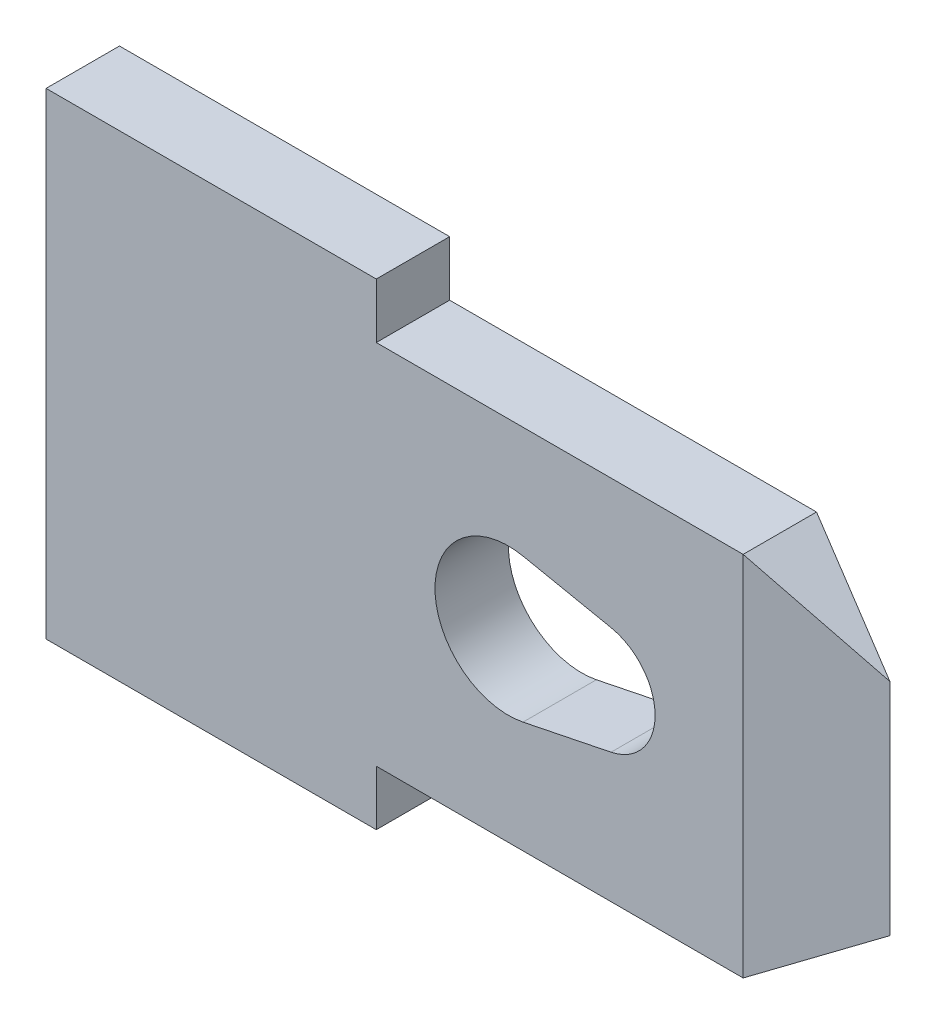
from build123d import *

# Parameters (mm, degrees)
DODANIE_WYCI_GNI_CIE1_DEPTH = 1
WYTNIJ_WYCI_GNI_CIE1_REACH  = 13.514
WYTNIJ_WYCI_GNI_CIE2_REACH  = 14.452


with BuildPart() as part:
    # Szkic1 → Dodanie-wyciągnięcie1 (new body)
    with BuildSketch(Plane.XY):
        Polygon((0, -3.25), (0, 3.25), (4.5, 3.25), (4.5, 2.5), (9.5, 2.5), (11, 1.5), (11, -1.5), (9.5, -2.5), (4.5, -2.5), (4.5, -3.25), align=None)
    extrude(amount=DODANIE_WYCI_GNI_CIE1_DEPTH)

    # Szkic2 → Wytnij-wyciągnięcie1 (cut, up to next)
    with BuildSketch(Plane.XY.offset(1), mode=Mode.PRIVATE) as wytnij_wyci_gni_cie1_sk1:
        with BuildLine():
            Line((6.5, 0.979795897), (7.7, 0.734846923))
            ThreePointArc((7.7, 0.734846923), (8.3, 0), (7.7, -0.734846923))
            Line((7.7, -0.734846923), (6.5, -0.979795897))
            ThreePointArc((6.5, -0.979795897), (5.3, 0), (6.5, 0.979795897))
        make_face()
    wytnij_wyci_gni_cie1_tool1 = extrude(wytnij_wyci_gni_cie1_sk1.sketch, amount=-WYTNIJ_WYCI_GNI_CIE1_REACH, mode=Mode.PRIVATE) & part.part
    add(wytnij_wyci_gni_cie1_tool1.solids().sort_by_distance((6.737463, 0, 1))[0], mode=Mode.SUBTRACT)

    # Wytnij-wyciągnięcie2: up to this plane
    wytnij_wyci_gni_cie2_end = Plane(origin=(9.5, -2.5, 1), z_dir=(-0.5547001962252293, 0.8320502943378437, 0))
    # Szkic3 → Wytnij-wyciągnięcie2 (cut, up to the surface)
    with BuildSketch(Plane(origin=(0, 2.5, 0), x_dir=(1, 0, 0), z_dir=(0, 1, 0)), mode=Mode.PRIVATE) as wytnij_wyci_gni_cie2_sk1:
        Polygon((11, -1), (11, -0.5), (9.5, -1), align=None)
    wytnij_wyci_gni_cie2_tool1 = split(extrude(wytnij_wyci_gni_cie2_sk1.sketch, amount=-WYTNIJ_WYCI_GNI_CIE2_REACH, mode=Mode.PRIVATE), bisect_by=wytnij_wyci_gni_cie2_end, keep=Keep.BOTH, mode=Mode.PRIVATE)
    add(wytnij_wyci_gni_cie2_tool1.solids().sort_by_distance((10.5, 2.5, 0.833333))[0], mode=Mode.SUBTRACT)
    # Szkic3 → Wytnij-wyciągnięcie2 (cut, up to the surface)
    with BuildSketch(Plane(origin=(0, 2.5, 0), x_dir=(1, 0, 0), z_dir=(0, 1, 0)), mode=Mode.PRIVATE) as wytnij_wyci_gni_cie2_sk2:
        Polygon((9.5, 0), (11, -0.5), (11, 0), align=None)
    wytnij_wyci_gni_cie2_tool2 = split(extrude(wytnij_wyci_gni_cie2_sk2.sketch, amount=-WYTNIJ_WYCI_GNI_CIE2_REACH, mode=Mode.PRIVATE), bisect_by=wytnij_wyci_gni_cie2_end, keep=Keep.BOTH, mode=Mode.PRIVATE)
    add(wytnij_wyci_gni_cie2_tool2.solids().sort_by_distance((10.5, 2.5, 0.166667))[0], mode=Mode.SUBTRACT)


solid = part.part
